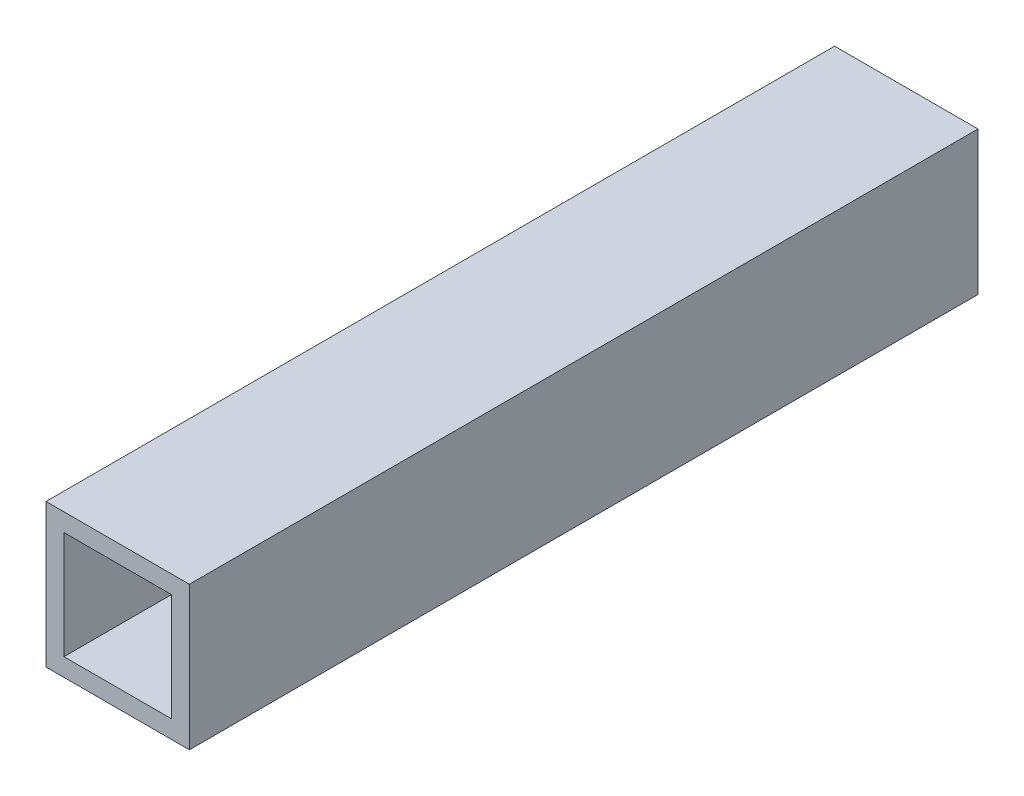
from build123d import *

# Parameters (mm, degrees)
SKETCH1_W           = 25.4
SKETCH1_H           = 25.4
SKETCH1_W_2         = 19.05
SKETCH1_H_2         = 19.05
BOSS_EXTRUDE1_DEPTH = 139.7


with BuildPart() as part:
    # Sketch1 → Boss-Extrude1 (new body)
    with BuildSketch(Plane.XY):
        with Locations((-12.7, 12.7)):
            Rectangle(SKETCH1_W, SKETCH1_H)
        with Locations((-12.7, 12.7)):
            Rectangle(SKETCH1_W_2, SKETCH1_H_2, mode=Mode.SUBTRACT)
    extrude(amount=BOSS_EXTRUDE1_DEPTH)


solid = part.part
